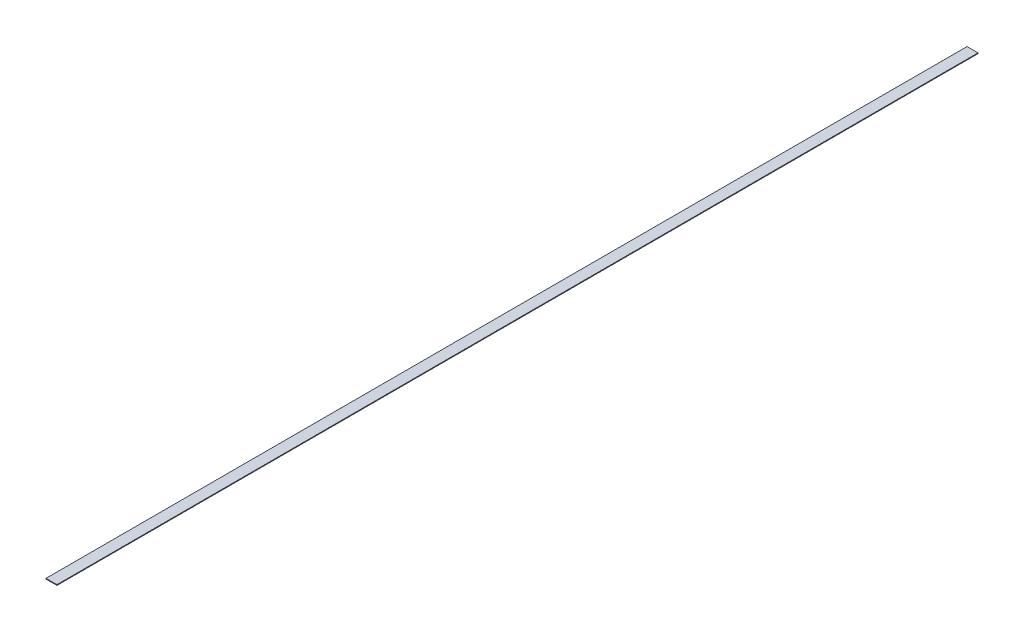
from build123d import *

# Parameters (mm, degrees)
SKETCH1_W      = 50.8
SKETCH1_H      = 3.175
EXTRUDE1_DEPTH = 4267.2


with BuildPart() as part:
    # Sketch1 → Extrude1 (new body)
    with BuildSketch(Plane.XY):
        Rectangle(SKETCH1_W, SKETCH1_H)
    extrude(amount=EXTRUDE1_DEPTH)


solid = part.part
